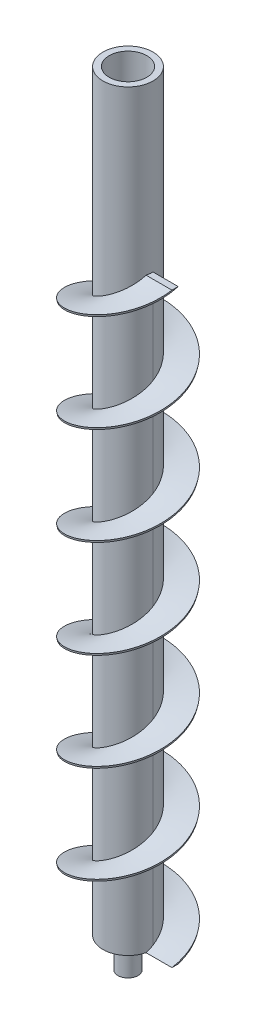
from build123d import *

# Parameters (mm, degrees)
SKETCH1_R          = 10
EXTRUDE1_DEPTH     = 300
SWEEP1_PITCH       = 39
SWEEP1_HEIGHT      = 234
SWEEP1_RADIUS      = 20
SWEEP1_START_ANGLE = 90
SKETCH3_W          = 20
SKETCH3_H          = 2.483406437
SKETCH4_R          = 4
EXTRUDE2_DEPTH     = 12
SKETCH5_R          = 7.5
EXTRUDE3_DEPTH     = 30
SKETCH6_R          = 2.6
EXTRUDE4_DEPTH     = 30


with BuildPart() as part:
    # Sketch1 → Extrude1 (new body)
    with BuildSketch(Plane(origin=(0, 0, 0), x_dir=(1, 0, 0), z_dir=(0, 1, 0))):
        with Locations(Location((0, 0, 0), (0, 0, 270))):
            Circle(SKETCH1_R)
    extrude(amount=EXTRUDE1_DEPTH)

    # Sweep1: sweep along a helix
    with BuildLine() as sweep1_path:
        add(Helix(SWEEP1_PITCH, SWEEP1_HEIGHT, SWEEP1_RADIUS, center=(0, 0, 0), direction=(0, 1, 0), mode=Mode.PRIVATE).rotate(Axis((0, 0, 0), (0, 1, 0)), SWEEP1_START_ANGLE))
    # Sketch3 → Sweep1 (sweep)
    with BuildSketch(Plane(origin=(0, 0, 0), x_dir=(-1, 0, 0), z_dir=(0, -1, 0))):
        with Locations((-10, -1.241703219)):
            Rectangle(SKETCH3_W, SKETCH3_H)
    sweep(path=sweep1_path.line, is_frenet=True)

    # Sketch4 → Extrude2 (add)
    with BuildSketch(Plane.XZ):
        with Locations(Location((0, 0, 0), (0, 0, 90))):
            Circle(SKETCH4_R)
    extrude(amount=EXTRUDE2_DEPTH)

    # Sketch5 → Extrude3 (cut)
    with BuildSketch(Plane(origin=(0, 300, 0), x_dir=(1, 0, 0), z_dir=(0, 1, 0))):
        with Locations(Location((0, 0, 0), (0, 0, 270))):
            Circle(SKETCH5_R)
    extrude(amount=-EXTRUDE3_DEPTH, mode=Mode.SUBTRACT)

    # Sketch6 → Extrude4 (cut)
    with BuildSketch(Plane.XY):
        with Locations((0, 288)):
            Circle(SKETCH6_R)
    extrude(amount=-EXTRUDE4_DEPTH, mode=Mode.SUBTRACT)


solid = part.part
